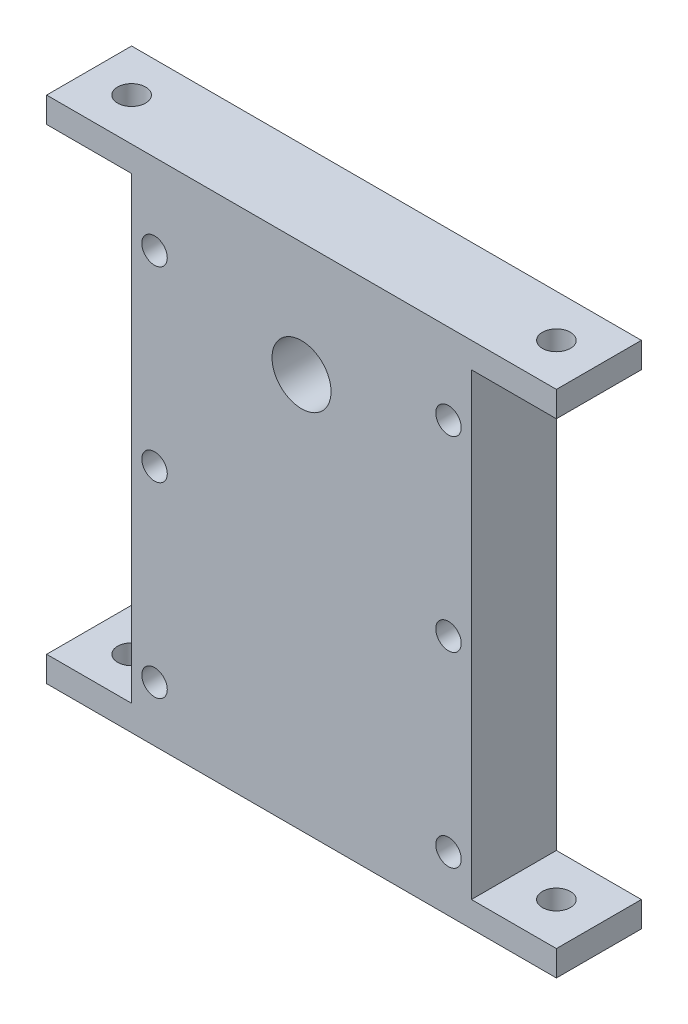
from build123d import *

# Parameters (mm, degrees)
SKETCH1_W                    = 40
SKETCH1_H                    = 60
SKETCH1_R                    = 3.475
SKETCH1_R_2                  = 1.5
BOSS_EXTRUDE1_DEPTH          = 10
ESQUISSE1_W                  = 10
ESQUISSE1_H                  = 3
BOSS_EXTRU_1_DEPTH           = 10
ESQUISSE2_W                  = 10
ESQUISSE2_H                  = 3
BOSS_EXTRU_2_DEPTH           = 10
ENL_V_MAT_EXTRU_1_DEPTH      = 66.184353951
ENL_V_MAT_EXTRU_1_DEPTH_BACK = 66.184353951
ESQUISSE3_R                  = 1.65


with BuildPart() as part:
    # Sketch1 → Boss-Extrude1 (new body)
    with BuildSketch(Plane.XY):
        Rectangle(SKETCH1_W, SKETCH1_H)
        with Locations((0, 16.5)):
            Circle(SKETCH1_R, mode=Mode.SUBTRACT)
        with Locations((-17.3, -1.5)):
            Circle(SKETCH1_R_2, mode=Mode.SUBTRACT)
        with Locations((-17.3, 20.5)):
            Circle(SKETCH1_R_2, mode=Mode.SUBTRACT)
        with Locations(Location((17.3, -1.5, 0), (0, 0, 180))):
            Circle(SKETCH1_R_2, mode=Mode.SUBTRACT)
        with Locations(Location((17.3, 20.5, 0), (0, 0, 180))):
            Circle(SKETCH1_R_2, mode=Mode.SUBTRACT)
        with Locations((-17.3, -23.5)):
            Circle(SKETCH1_R_2, mode=Mode.SUBTRACT)
        with Locations(Location((17.3, -23.5, 0), (0, 0, 180))):
            Circle(SKETCH1_R_2, mode=Mode.SUBTRACT)
    extrude(amount=BOSS_EXTRUDE1_DEPTH)

    # Esquisse1 → Boss.-Extru.1 (add)
    with BuildSketch(Plane(origin=(20, 0, 0), x_dir=(0, 0, -1), z_dir=(1, 0, 0))):
        with Locations((-5, 28.5)):
            Rectangle(ESQUISSE1_W, ESQUISSE1_H)
        with Locations((-5, -28.5)):
            Rectangle(ESQUISSE1_W, ESQUISSE1_H)
    extrude(amount=BOSS_EXTRU_1_DEPTH)

    # Esquisse2 → Boss.-Extru.2 (add)
    with BuildSketch(Plane.ZY.offset(20)):
        with Locations((5, 28.5)):
            Rectangle(ESQUISSE2_W, ESQUISSE2_H)
        with Locations((5, -28.5)):
            Rectangle(ESQUISSE2_W, ESQUISSE2_H)
    extrude(amount=BOSS_EXTRU_2_DEPTH)

    # Esquisse3 → Enlèv. mat.-Extru.1 (cut, two sides: drawn at the far end of the back side and taken through both)
    with BuildSketch(Plane.XZ.offset(-27).offset(-ENL_V_MAT_EXTRU_1_DEPTH_BACK)):
        with Locations((-25, 5)):
            Circle(ESQUISSE3_R)
        with Locations((25, 5)):
            Circle(ESQUISSE3_R)
    extrude(amount=ENL_V_MAT_EXTRU_1_DEPTH + ENL_V_MAT_EXTRU_1_DEPTH_BACK, mode=Mode.SUBTRACT)


solid = part.part
